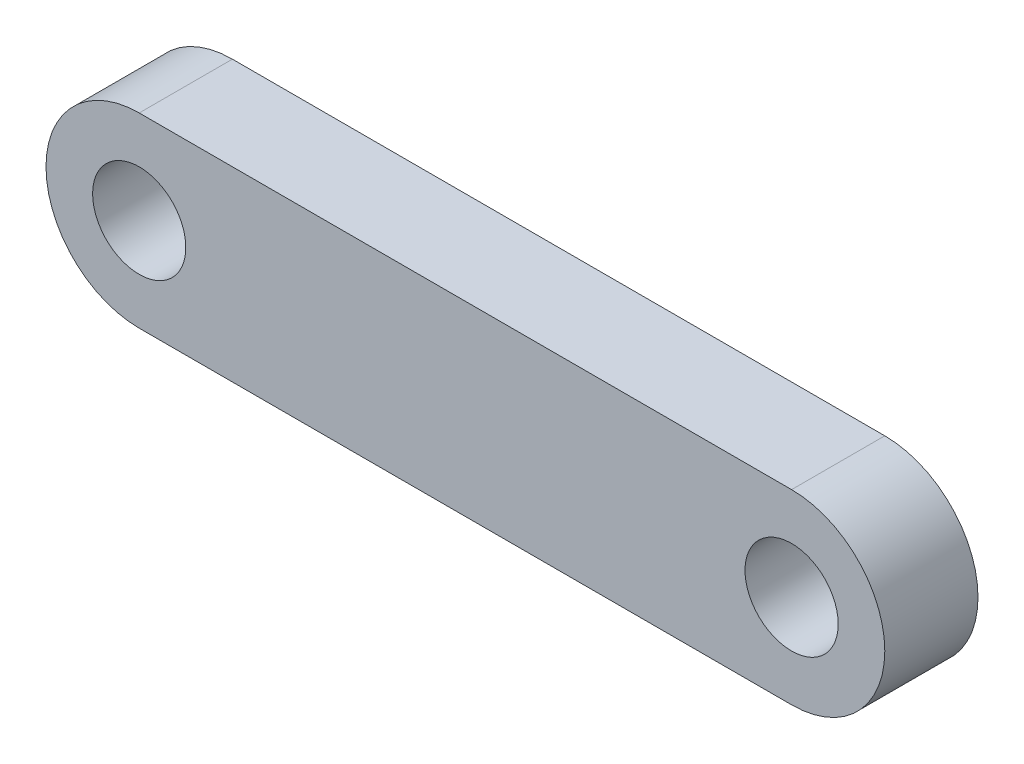
from build123d import *

# Parameters (mm, degrees)
SKETCH1_R           = 5
BOSS_EXTRUDE1_DEPTH = 10


with BuildPart() as part:
    # Sketch1 → Boss-Extrude1 (new body)
    with BuildSketch(Plane.XY):
        with BuildLine():
            Line((-35, 10), (35, 10))
            ThreePointArc((35, 10), (45, 0), (35, -10))
            Line((35, -10), (-35, -10))
            ThreePointArc((-35, -10), (-45, 0), (-35, 10))
        make_face()
        with Locations((35, 0)):
            Circle(SKETCH1_R, mode=Mode.SUBTRACT)
        with Locations(Location((-35, 0, 0), (0, 0, 180))):
            Circle(SKETCH1_R, mode=Mode.SUBTRACT)
    extrude(amount=BOSS_EXTRUDE1_DEPTH)


solid = part.part
